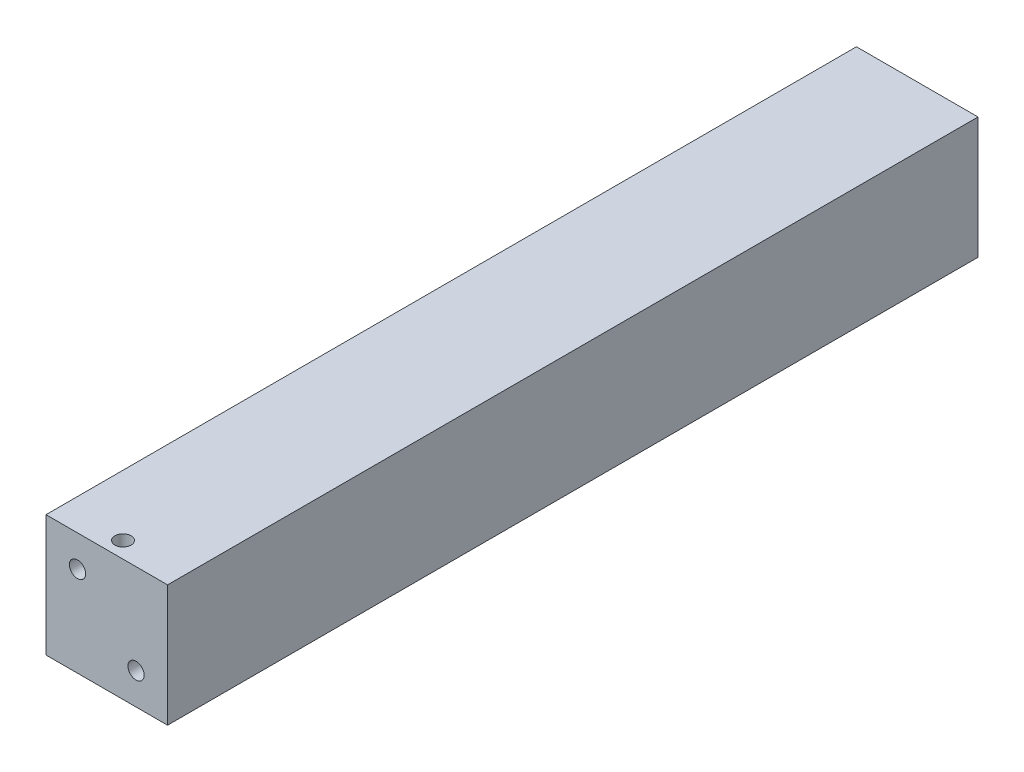
from build123d import *

# Parameters (mm, degrees)
CROQUIS1_W              = 30
CROQUIS1_H              = 30
SALIENTE_EXTRUIR1_DEPTH = 200
CROQUIS2_R              = 2
CORTAR_EXTRUIR1_DEPTH   = 25
CROQUIS3_R              = 2
CORTAR_EXTRUIR2_DEPTH   = 203.792997907
CROQUIS4_R              = 2
CORTAR_EXTRUIR3_DEPTH   = 25


with BuildPart() as part:
    # Croquis1 → Saliente-Extruir1 (new body)
    with BuildSketch(Plane.XY):
        Rectangle(CROQUIS1_W, CROQUIS1_H)
    extrude(amount=SALIENTE_EXTRUIR1_DEPTH)

    # Croquis2 → Cortar-Extruir1 (cut)
    with BuildSketch(Plane.XY.offset(200)):
        with Locations((-7.221825407, 7.221825407)):
            Circle(CROQUIS2_R)
        with Locations(Location((7.221825407, -7.221825407, 0), (0, 0, 180))):
            Circle(CROQUIS2_R)
    extrude(amount=-CORTAR_EXTRUIR1_DEPTH, mode=Mode.SUBTRACT)

    # Croquis3 → Cortar-Extruir2 (cut, through all)
    with BuildSketch(Plane(origin=(0, 15, 0), x_dir=(1, 0, 0), z_dir=(0, 1, 0))):
        with Locations(Location((0, -196, 0), (0, 0, 270))):
            Circle(CROQUIS3_R)
    extrude(amount=-CORTAR_EXTRUIR2_DEPTH, mode=Mode.SUBTRACT)

    # Croquis4 → Cortar-Extruir3 (cut)
    with BuildSketch(Plane(origin=(0, 0, 0), x_dir=(-1, 0, 0), z_dir=(0, 0, -1))):
        Circle(CROQUIS4_R)
    extrude(amount=-CORTAR_EXTRUIR3_DEPTH, mode=Mode.SUBTRACT)


solid = part.part
